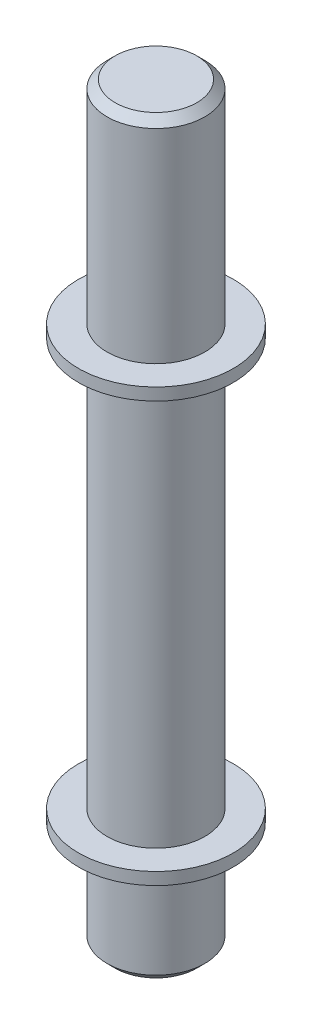
from build123d import *

# Parameters (mm, degrees)
CHAMFER1_SIZE = 2


with BuildPart() as part:
    # Sketch1 → Revolve1 (revolve)
    with BuildSketch(Plane.XY, mode=Mode.PRIVATE) as revolve1_sk:
        Polygon((0, 0), (12, 0), (12, 26), (19, 26), (19, 29), (12, 29), (12, 129), (19, 129), (19, 132), (12, 132), (12, 184), (0, 184), align=None)
    revolve(revolve1_sk.sketch.rotate(Axis((0, 184, 0), (0, -1, 0)), 180), axis=Axis((0, 184, 0), (0, -1, 0)))

    # Chamfer1
    chamfer1_edges = [part.edges().sort_by_distance(p)[0] for p in [
        (12, 0, 0),
        (12, 184, 0),
    ]]
    chamfer(chamfer1_edges, length=CHAMFER1_SIZE)


solid = part.part
